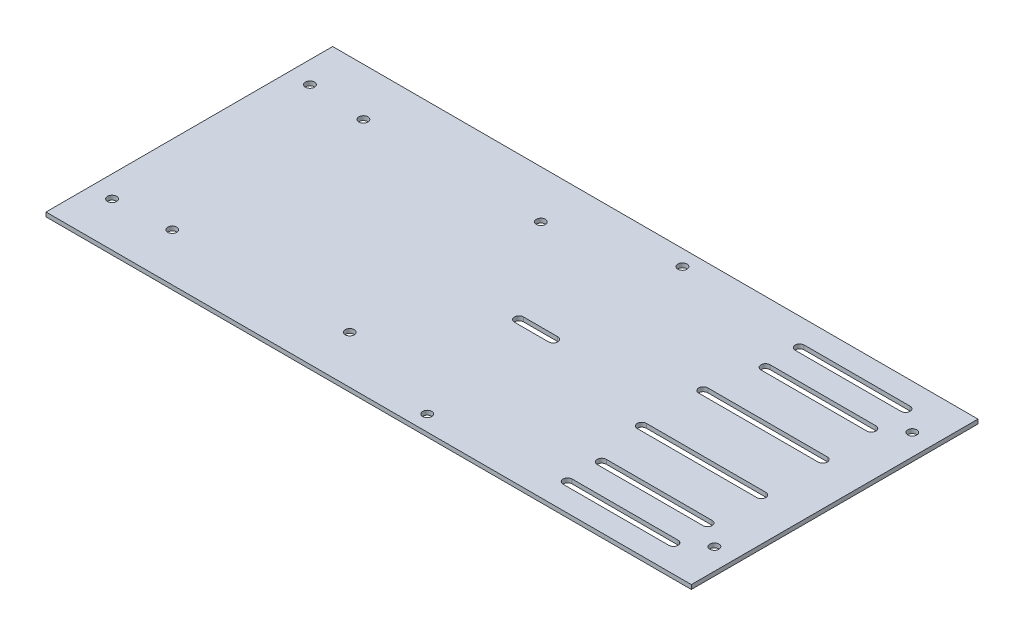
from build123d import *

# Parameters (mm, degrees)
SKETCH1_R           = 3.3782
BOSS_EXTRUDE1_DEPTH = 3.175


with BuildPart() as part:
    # Sketch1 → Boss-Extrude1 (new body)
    with BuildSketch(Plane(origin=(0, 0, 0), x_dir=(1, 0, 0), z_dir=(0, 1, 0))):
        Polygon((-240.157, 106.68), (240.157, 106.68), (240.157, -73.66), (240.157, -106.68), (-240.157, -106.68), align=None)
        with Locations(Location((224.282, -73.66, 0), (0, 0, 270))):
            Circle(SKETCH1_R, mode=Mode.SUBTRACT)
        with Locations(Location((31.877, -94.9833, 0), (0, 0, 270))):
            Circle(SKETCH1_R, mode=Mode.SUBTRACT)
        with Locations(Location((31.877, 94.9833, 0), (0, 0, 90))):
            Circle(SKETCH1_R, mode=Mode.SUBTRACT)
        with Locations(Location((224.282, 73.66, 0), (0, 0, 90))):
            Circle(SKETCH1_R, mode=Mode.SUBTRACT)
        with Locations(Location((-224.028, 73.66, 0), (0, 0, 90))):
            Circle(SKETCH1_R, mode=Mode.SUBTRACT)
        with Locations(Location((-224.028, -73.66, 0), (0, 0, 270))):
            Circle(SKETCH1_R, mode=Mode.SUBTRACT)
        with Locations(Location((-181.737, 71.12, 0), (0, 0, 270))):
            Circle(SKETCH1_R, mode=Mode.SUBTRACT)
        with Locations(Location((-49.657, 71.12, 0), (0, 0, 270))):
            Circle(SKETCH1_R, mode=Mode.SUBTRACT)
        with Locations(Location((-49.657, -71.12, 0), (0, 0, 90))):
            Circle(SKETCH1_R, mode=Mode.SUBTRACT)
        with Locations(Location((-181.737, -71.12, 0), (0, 0, 90))):
            Circle(SKETCH1_R, mode=Mode.SUBTRACT)
        with BuildLine():
            Line((119.507, -19.4818), (208.407, -19.4818))
            ThreePointArc((208.407, -19.4818), (211.7852, -22.86), (208.407, -26.2382))
            Line((208.407, -26.2382), (119.507, -26.2382))
            ThreePointArc((119.507, -26.2382), (116.1288, -22.86), (119.507, -19.4818))
        make_face(mode=Mode.SUBTRACT)
        with BuildLine():
            Line((119.507, 19.4818), (208.407, 19.4818))
            ThreePointArc((208.407, 19.4818), (211.7852, 22.86), (208.407, 26.2382))
            Line((208.407, 26.2382), (119.507, 26.2382))
            ThreePointArc((119.507, 26.2382), (116.1288, 22.86), (119.507, 19.4818))
        make_face(mode=Mode.SUBTRACT)
        with BuildLine():
            Line((127.762, -57.5818), (206.502, -57.5818))
            ThreePointArc((206.502, -57.5818), (209.8802, -60.96), (206.502, -64.3382))
            Line((206.502, -64.3382), (127.762, -64.3382))
            ThreePointArc((127.762, -64.3382), (124.3838, -60.96), (127.762, -57.5818))
        make_face(mode=Mode.SUBTRACT)
        with BuildLine():
            Line((127.762, -89.7382), (206.502, -89.7382))
            ThreePointArc((206.502, -89.7382), (209.8802, -86.36), (206.502, -82.9818))
            Line((206.502, -82.9818), (127.762, -82.9818))
            ThreePointArc((127.762, -82.9818), (124.3838, -86.36), (127.762, -89.7382))
        make_face(mode=Mode.SUBTRACT)
        with BuildLine():
            Line((127.762, 57.5818), (206.502, 57.5818))
            ThreePointArc((206.502, 57.5818), (209.8802, 60.96), (206.502, 64.3382))
            Line((206.502, 64.3382), (127.762, 64.3382))
            ThreePointArc((127.762, 64.3382), (124.3838, 60.96), (127.762, 57.5818))
        make_face(mode=Mode.SUBTRACT)
        with BuildLine():
            Line((127.762, 89.7382), (206.502, 89.7382))
            ThreePointArc((206.502, 89.7382), (209.8802, 86.36), (206.502, 82.9818))
            Line((206.502, 82.9818), (127.762, 82.9818))
            ThreePointArc((127.762, 82.9818), (124.3838, 86.36), (127.762, 89.7382))
        make_face(mode=Mode.SUBTRACT)
        with BuildLine():
            Line((5.207, 3.3782), (30.607, 3.3782))
            ThreePointArc((30.607, 3.3782), (33.9852, 0), (30.607, -3.3782))
            Line((30.607, -3.3782), (5.207, -3.3782))
            ThreePointArc((5.207, -3.3782), (1.8288, 0), (5.207, 3.3782))
        make_face(mode=Mode.SUBTRACT)
    extrude(amount=BOSS_EXTRUDE1_DEPTH)


solid = part.part
